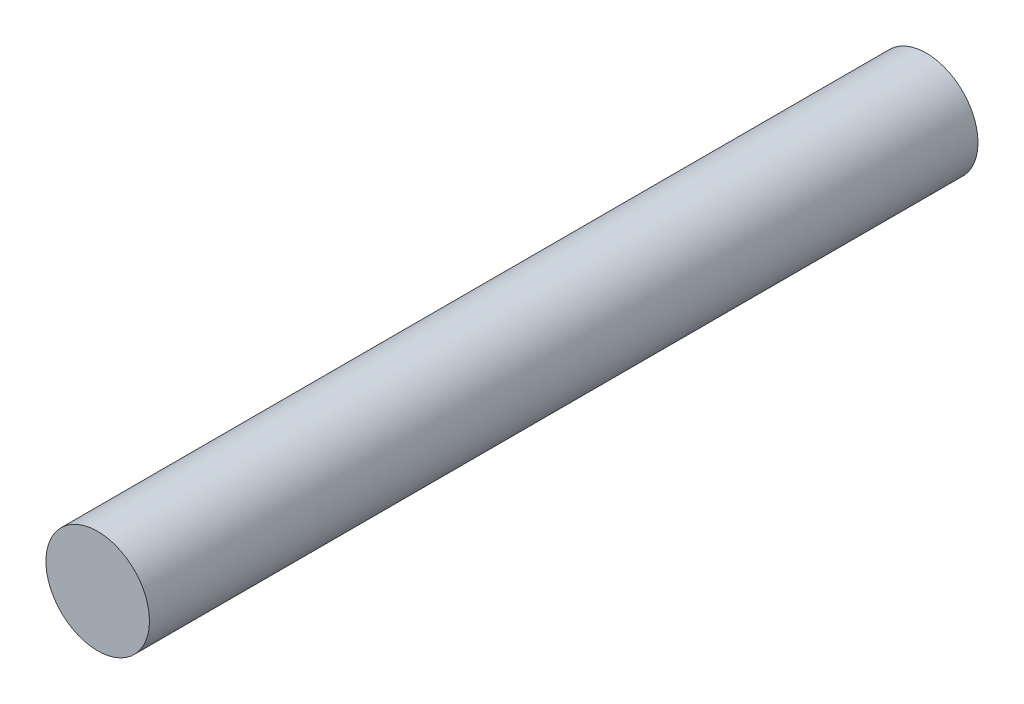
from build123d import *

# Parameters (mm, degrees)
INSTALLED_D1X8_COILED_PIN_ENVELOPE_START = -4
SKETCH1_R                                = 0.5
INSTALLED_D1X8_COILED_PIN_ENVELOPE_DEPTH = 8


with BuildPart() as part:
    # Sketch1 → Installed_D1x8_Coiled_Pin_Envelope (new body)
    with BuildSketch(Plane.XY.offset(INSTALLED_D1X8_COILED_PIN_ENVELOPE_START)):
        Circle(SKETCH1_R)
    extrude(amount=INSTALLED_D1X8_COILED_PIN_ENVELOPE_DEPTH)


solid = part.part
